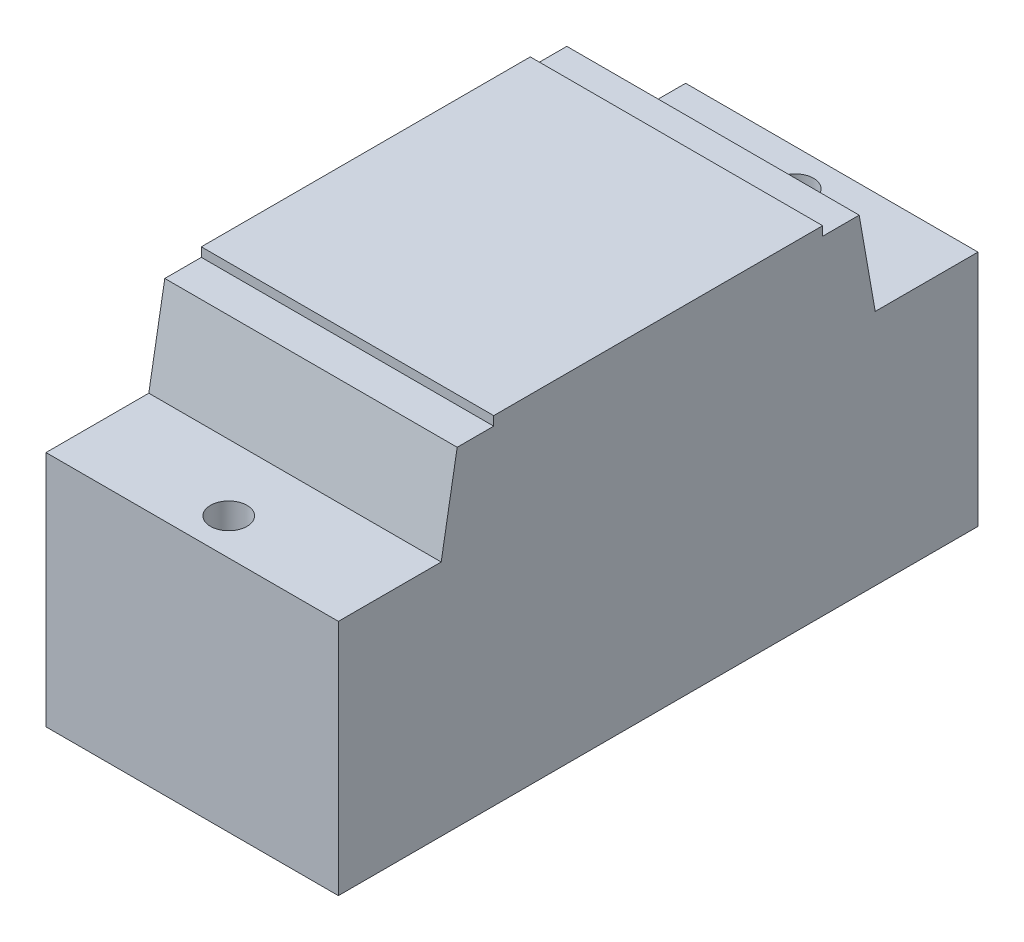
from build123d import *

# Parameters (mm, degrees)
SKETCH_1_W          = 32
SKETCH_1_H          = 70
EXTRUDE_1_DEPTH     = 26
SKETCH_2_W          = 36
SKETCH_2_H          = 1
EXTRUDE_2_DEPTH     = 32
SKETCH_3_R          = 2
CUT_EXTRUDE_1_DEPTH = 54.38539126


with BuildPart() as part:
    # ｽｹｯﾁ1 → ﾎﾞｽ - 押し出し1 (new body)
    with BuildSketch(Plane(origin=(0, 0, 0), x_dir=(1, 0, 0), z_dir=(0, 1, 0))):
        Rectangle(SKETCH_1_W, SKETCH_1_H)
    extrude(amount=EXTRUDE_1_DEPTH)

    # ｽｹｯﾁ2 → ﾎﾞｽ - 押し出し2 (add)
    with BuildSketch(Plane(origin=(16, 0, 0), x_dir=(0, 0, -1), z_dir=(1, 0, 0))):
        Polygon((-18, 36), (-22, 36), (-22, 26), (22, 26), (22, 36), (18, 36), align=None)
        with Locations((0, 36.5)):
            Rectangle(SKETCH_2_W, SKETCH_2_H)
        Polygon((-22, 26), (-22, 36), (-23.75, 26), align=None)
        Polygon((22, 36), (22, 26), (23.75, 26), align=None)
    extrude(amount=-EXTRUDE_2_DEPTH)

    # ｽｹｯﾁ3 → ｶｯﾄ - 押し出し1 (cut, through all)
    with BuildSketch(Plane.XZ):
        with Locations(Location((0, 31, 0), (0, 0, 270))):
            Circle(SKETCH_3_R)
        with Locations(Location((0, -31, 0), (0, 0, 90))):
            Circle(SKETCH_3_R)
    extrude(amount=-CUT_EXTRUDE_1_DEPTH, mode=Mode.SUBTRACT)


solid = part.part
